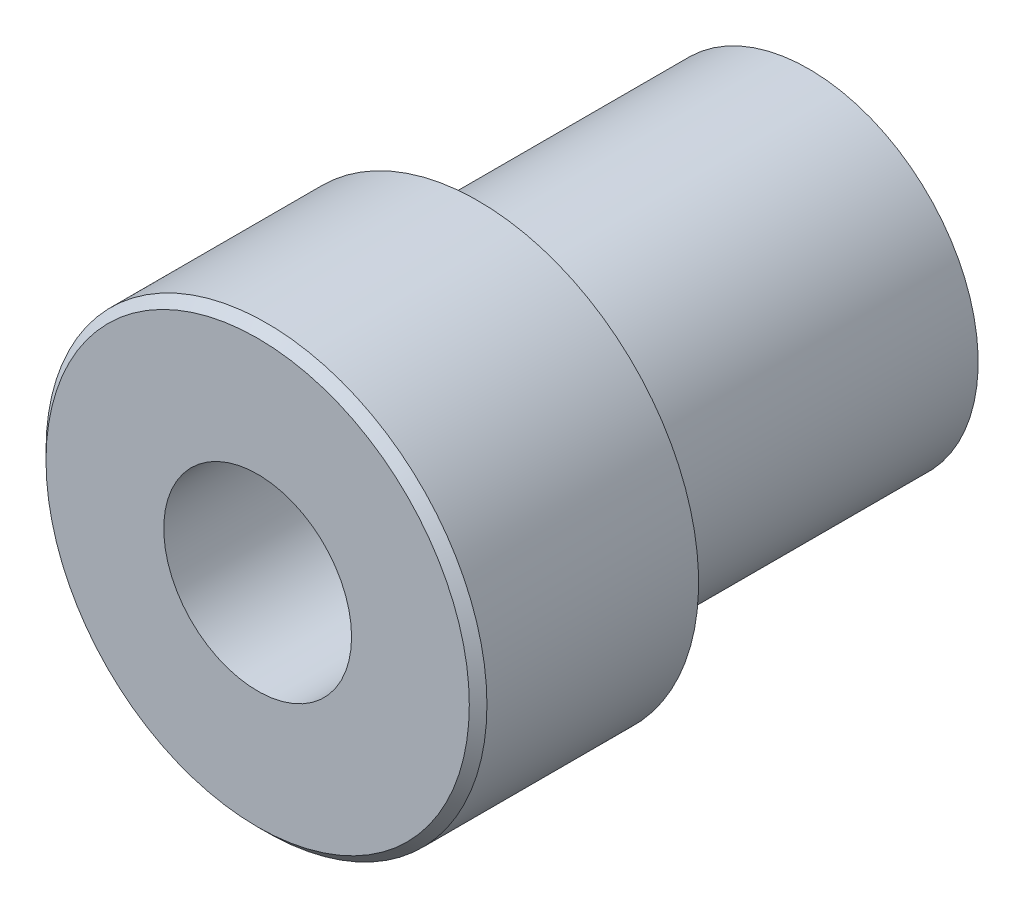
from build123d import *

# Parameters (mm, degrees)
SKETCH1_R                   = 6.35
BOSS_EXTRUDE1_DEPTH         = 15.875
CHAMFER1_SIZE               = 0.254
SKETCH2_OUTSIDE_W           = 19.494
SKETCH2_OUTSIDE_H           = 19.494
SKETCH2_OUTSIDE_R           = 4.8768
CUT_EXTRUDE1_DEPTH          = 9.525
TAP_DRILL_FOR_1_4_28_TAP1_D = 5.4102


with BuildPart() as part:
    # Sketch1 → Boss-Extrude1 (new body)
    with BuildSketch(Plane.XY):
        Circle(SKETCH1_R)
    extrude(amount=BOSS_EXTRUDE1_DEPTH)

    # Chamfer1
    chamfer1_edges = [part.edges().sort_by_distance(p)[0] for p in [
        (-6.35, 0, 15.875),
    ]]
    chamfer(chamfer1_edges, length=CHAMFER1_SIZE)

    # Sketch2 outside → Cut-Extrude1 (cut)
    with BuildSketch(Plane(origin=(0, 0, 0), x_dir=(-1, 0, 0), z_dir=(0, 0, -1))):
        Rectangle(SKETCH2_OUTSIDE_W, SKETCH2_OUTSIDE_H)
        Circle(SKETCH2_OUTSIDE_R, mode=Mode.SUBTRACT)
    extrude(amount=-CUT_EXTRUDE1_DEPTH, mode=Mode.SUBTRACT)

    # Tap Drill for 1/4-28 Tap1 (through all)
    with Locations(Plane.XY.offset(15.875)):
        with Locations((0, 0)):
            Hole(TAP_DRILL_FOR_1_4_28_TAP1_D / 2)


solid = part.part
